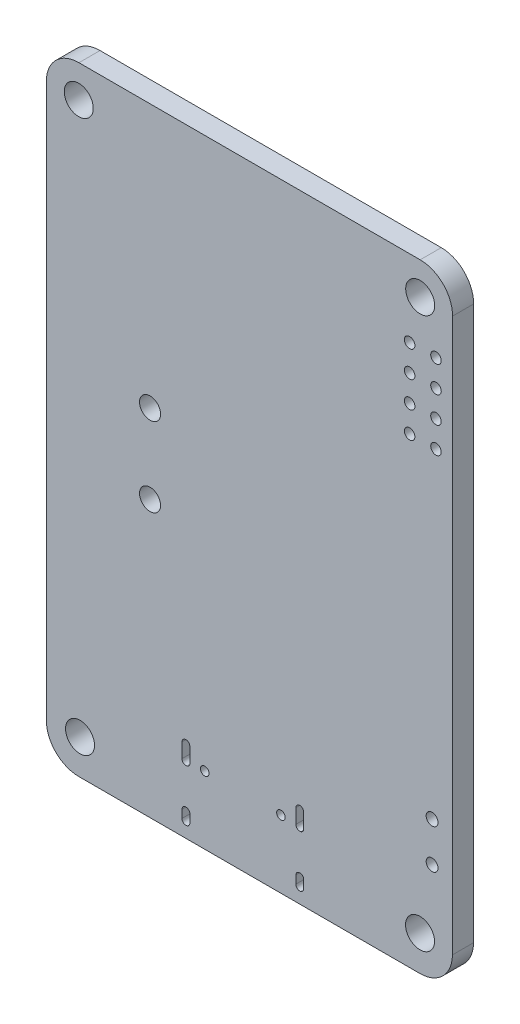
from build123d import *

# Parameters (mm, degrees)
SKETCH_1_R      = 1.1
SKETCH_1_R_2    = 0.45
SKETCH_1_R_3    = 0.325
SKETCH_1_R_4    = 0.8
SKETCH_1_R_5    = 0.4
SKETCH_1_R_6    = 1.099998
EXTRUDE_1_DEPTH = 1.6


with BuildPart() as part:
    # 草图1 → 凸台-拉伸1 (new body)
    with BuildSketch(Plane(origin=(0, 0, 0), x_dir=(-1, 0, 0), z_dir=(0, 0, -1))):
        with BuildLine():
            Line((-28.92416249, 0.002948493), (-3.030002484, 0.0047195))
            ThreePointArc((-3.030002484, 0.0047195), (-1.293435555, 0.73352407), (-0.582919351, 2.477653515))
            Line((-0.582919351, 2.477653515), (-0.581684294, 44.468735287))
            ThreePointArc((-0.581684294, 44.468735287), (-1.306942661, 46.21181505), (-3.054644493, 46.925863413))
            Line((-3.054644493, 46.925863413), (-28.9511375, 46.920055471))
            ThreePointArc((-28.9511375, 46.920055471), (-30.694165746, 46.194778446), (-31.408188877, 44.447109943))
            Line((-31.408188877, 44.447109943), (-31.397105, 2.460002))
            ThreePointArc((-31.397105, 2.460002), (-30.671824776, 0.716978502), (-28.92416249, 0.002948493))
        make_face()
        with Locations(Location((-28.94, 2.662946, 0), (0, 0, 180))):
            Circle(SKETCH_1_R, mode=Mode.SUBTRACT)
        with Locations(Location((-29.855, 7.61, 0), (0, 0, 180))):
            Circle(SKETCH_1_R_2, mode=Mode.SUBTRACT)
        with Locations(Location((-29.855, 10.61, 0), (0, 0, 180))):
            Circle(SKETCH_1_R_2, mode=Mode.SUBTRACT)
        with Locations(Location((-18.384, 5.145, 0), (0, 0, 180))):
            Circle(SKETCH_1_R_3, mode=Mode.SUBTRACT)
        with Locations(Location((-12.604, 5.145, 0), (0, 0, 180))):
            Circle(SKETCH_1_R_3, mode=Mode.SUBTRACT)
        with Locations(Location((-3.136974, 2.65, 0), (0, 0, 180))):
            Circle(SKETCH_1_R, mode=Mode.SUBTRACT)
        with Locations(Location((-8.45, 20.925, 0), (0, 0, 180))):
            Circle(SKETCH_1_R_4, mode=Mode.SUBTRACT)
        with Locations(Location((-30.15, 35.08, 0), (0, 0, 180))):
            Circle(SKETCH_1_R_5, mode=Mode.SUBTRACT)
        with Locations(Location((-30.15, 37.08, 0), (0, 0, 180))):
            Circle(SKETCH_1_R_5, mode=Mode.SUBTRACT)
        with Locations(Location((-28.15, 35.08, 0), (0, 0, 180))):
            Circle(SKETCH_1_R_5, mode=Mode.SUBTRACT)
        with Locations(Location((-28.15, 37.08, 0), (0, 0, 180))):
            Circle(SKETCH_1_R_5, mode=Mode.SUBTRACT)
        with Locations(Location((-30.15, 39.08, 0), (0, 0, 180))):
            Circle(SKETCH_1_R_5, mode=Mode.SUBTRACT)
        with Locations(Location((-28.15, 39.08, 0), (0, 0, 180))):
            Circle(SKETCH_1_R_5, mode=Mode.SUBTRACT)
        with Locations(Location((-30.15, 41.08, 0), (0, 0, 180))):
            Circle(SKETCH_1_R_5, mode=Mode.SUBTRACT)
        with Locations(Location((-28.15, 41.08, 0), (0, 0, 180))):
            Circle(SKETCH_1_R_5, mode=Mode.SUBTRACT)
        with Locations(Location((-28.951135, 44.462946, 0), (0, 0, 180))):
            Circle(SKETCH_1_R, mode=Mode.SUBTRACT)
        with Locations(Location((-8.45, 26.925, 0), (0, 0, 180))):
            Circle(SKETCH_1_R_4, mode=Mode.SUBTRACT)
        with Locations(Location((-3.038791293, 44.468807556, 0), (0, 0, 180))):
            Circle(SKETCH_1_R_6, mode=Mode.SUBTRACT)
        with BuildLine():
            Line((-19.514, 1.765), (-19.514, 1.165))
            ThreePointArc((-19.514, 1.165), (-19.814, 0.865), (-20.114, 1.165))
            Line((-20.114, 1.165), (-20.114, 1.765))
            ThreePointArc((-20.114, 1.765), (-19.814, 2.065), (-19.514, 1.765))
        make_face(mode=Mode.SUBTRACT)
        with BuildLine():
            Line((-19.514, 6.195), (-19.514, 5.095))
            ThreePointArc((-19.514, 5.095), (-19.814, 4.795), (-20.114, 5.095))
            Line((-20.114, 5.095), (-20.114, 6.195))
            ThreePointArc((-20.114, 6.195), (-19.814, 6.495), (-19.514, 6.195))
        make_face(mode=Mode.SUBTRACT)
        with BuildLine():
            Line((-10.874, 1.765), (-10.874, 1.165))
            ThreePointArc((-10.874, 1.165), (-11.174, 0.865), (-11.474, 1.165))
            Line((-11.474, 1.165), (-11.474, 1.765))
            ThreePointArc((-11.474, 1.765), (-11.174, 2.065), (-10.874, 1.765))
        make_face(mode=Mode.SUBTRACT)
        with BuildLine():
            Line((-10.874, 6.195), (-10.874, 5.095))
            ThreePointArc((-10.874, 5.095), (-11.174, 4.795), (-11.474, 5.095))
            Line((-11.474, 5.095), (-11.474, 6.195))
            ThreePointArc((-11.474, 6.195), (-11.174, 6.495), (-10.874, 6.195))
        make_face(mode=Mode.SUBTRACT)
    extrude(amount=-EXTRUDE_1_DEPTH)


solid = part.part
